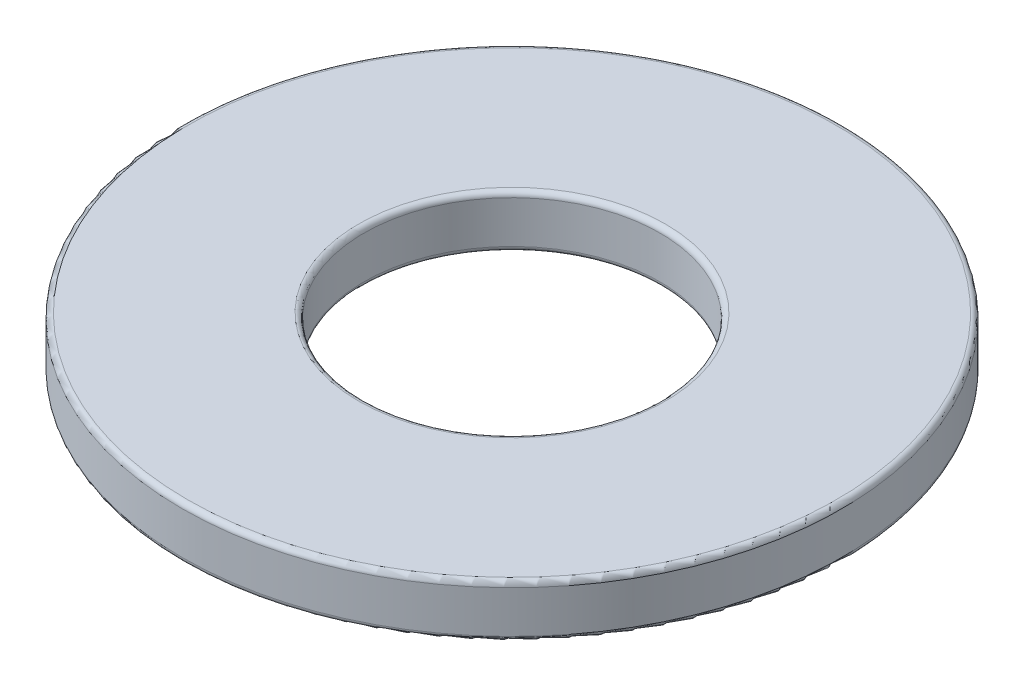
from build123d import *

# Parameters (mm, degrees)
SKETCH1_R           = 7.9375
SKETCH1_R_2         = 3.5687
BOSS_EXTRUDE1_DEPTH = 1.27
FILLET1_R           = 0.127


with BuildPart() as part:
    # Sketch1 → Boss-Extrude1 (new body)
    with BuildSketch(Plane(origin=(0, 0, 0), x_dir=(1, 0, 0), z_dir=(0, 1, 0))):
        with Locations(Location((0, 0, 0), (0, 0, 270))):
            Circle(SKETCH1_R)
        with Locations(Location((0, 0, 0), (0, 0, 270))):
            Circle(SKETCH1_R_2, mode=Mode.SUBTRACT)
    extrude(amount=BOSS_EXTRUDE1_DEPTH)

    # Fillet1
    fillet1_edges = [part.edges().sort_by_distance(p)[0] for p in [
        (0, 0, -7.9375),
        (0, 1.27, -7.9375),
        (0, 0, -3.5687),
        (0, 1.27, -3.5687),
    ]]
    fillet(fillet1_edges, radius=FILLET1_R)


solid = part.part
